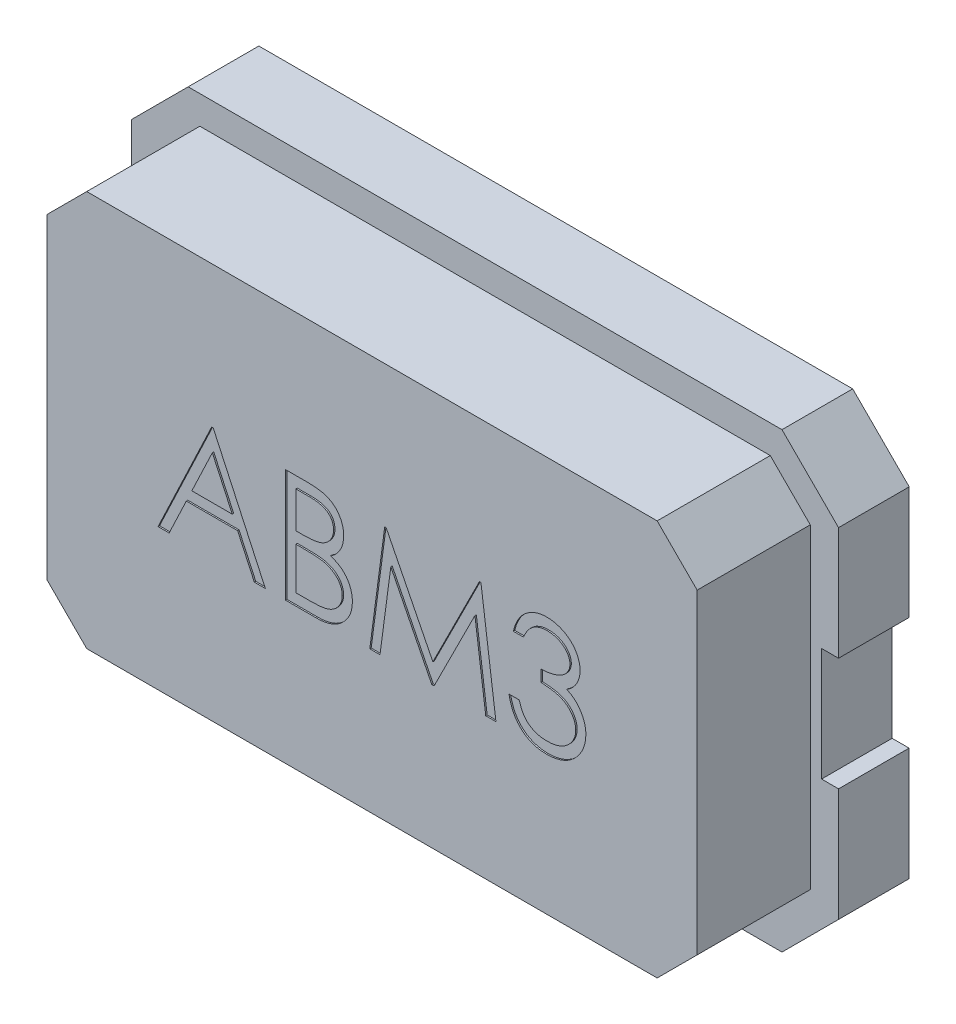
from build123d import *

# Parameters (mm, degrees)
SKETCH1_W           = 5
SKETCH1_H           = 3.2
BOSS_EXTRUDE1_DEPTH = 0.5
CHAMFER1_SIZE       = 0.4
BOSS_EXTRUDE2_DEPTH = 0.8
CUT_EXTRUDE1_DEPTH  = 0.01
SKETCH4_W           = 0.269976204
SKETCH4_H           = 0.8
CUT_EXTRUDE2_DEPTH  = 4.074085256
SKETCH6_W           = 1.3
SKETCH6_H           = 2
CUT_EXTRUDE3_DEPTH  = 0.001


with BuildPart() as part:
    # Sketch1 → Boss-Extrude1 (new body)
    with BuildSketch(Plane.XY):
        Rectangle(SKETCH1_W, SKETCH1_H)
    extrude(amount=BOSS_EXTRUDE1_DEPTH)

    # Chamfer1
    chamfer1_edges = [part.edges().sort_by_distance(p)[0] for p in [
        (2.5, -1.6, 0.25),
        (-2.5, -1.6, 0.25),
        (-2.5, 1.6, 0.25),
        (2.5, 1.6, 0.25),
    ]]
    chamfer(chamfer1_edges, length=CHAMFER1_SIZE)

    # Sketch2 → Boss-Extrude2 (add)
    with BuildSketch(Plane.XY.offset(0.5)):
        Polygon((2.017157288, 1.4), (-2.017157288, 1.4), (-2.3, 1.117157288), (-2.3, -1.117157288), (-2.017157288, -1.4), (2.017157288, -1.4), (2.3, -1.117157288), (2.3, 1.117157288), align=None)
    extrude(amount=BOSS_EXTRUDE2_DEPTH)

    # Sketch3 → Cut-Extrude1 (cut)
    # profile 1 of 4: a face of its own
    with BuildSketch(Plane.XY.offset(1.3)):
        Polygon((-1.123076923, 0.4), (-0.753846154, -0.4), (-0.831891026, -0.4), (-0.950160256, -0.143589744), (-1.312820513, -0.143589744), (-1.434455128, -0.4), (-1.512820513, -0.4), (-1.133333333, 0.4), align=None)
        Polygon((-1.12900641, 0.244070513), (-1.273878205, -0.061538462), (-0.987980769, -0.061538462), align=None, mode=Mode.SUBTRACT)
    # profile 2 of 4: a face of its own
    with BuildSketch(Plane.XY.offset(1.3)):
        with BuildLine():
            Line((-0.61025641, 0.4), (-0.454166667, 0.4))
            add(Edge.make_bspline(
                [(-0.454166667, 0.4), (-0.446525872, 0.399959828), (-0.431716109, 0.399881966), (-0.410180237, 0.398674393), (-0.39000908, 0.39702784), (-0.371196789, 0.394415248), (-0.353752057, 0.391262841), (-0.337622312, 0.387445283), (-0.322858844, 0.382867772), (-0.305233075, 0.375588622), (-0.285136924, 0.364771897), (-0.263377292, 0.348788225), (-0.244770608, 0.329237948), (-0.228728022, 0.30718477), (-0.21597348, 0.282925165), (-0.206746212, 0.25703735), (-0.200904412, 0.229855238), (-0.200303627, 0.21119394), (-0.2, 0.201762821)],
                knots=[0, 0, 0, 0, 1.001505555, 1.941167018, 2.826882275, 3.653841531, 4.429895133, 5.150066043, 5.825578002, 6.45369114, 7.647487171, 8.808567382, 9.977351308, 11.170798116, 12.373658725, 13.556498008, 14.765093433, 16, 16, 16, 16], degree=3))
            add(Edge.make_bspline(
                [(-0.2, 0.201762821), (-0.200249879, 0.192927951), (-0.200740913, 0.175566598), (-0.205436401, 0.150173659), (-0.212787411, 0.126001952), (-0.223005754, 0.103139692), (-0.23628621, 0.082103438), (-0.252025254, 0.062723491), (-0.271014238, 0.045820393), (-0.285241264, 0.036370586), (-0.292467949, 0.031570513)],
                knots=[0, 0, 0, 0, 1.044552857, 2.05264487, 3.044412934, 4.028983338, 5.005914585, 5.980388656, 6.974128949, 8, 8, 8, 8], degree=3))
            add(Edge.make_bspline(
                [(-0.292467949, 0.031570513), (-0.283379851, 0.02808137), (-0.265992069, 0.021405776), (-0.242063837, 0.009603384), (-0.221447873, -0.00323367), (-0.203985668, -0.017252378), (-0.189051347, -0.032362963), (-0.176010674, -0.04878699), (-0.164883503, -0.066738706), (-0.155349121, -0.086030942), (-0.147909405, -0.106466706), (-0.14233777, -0.127854312), (-0.13914521, -0.150117068), (-0.138690892, -0.165268012), (-0.138461538, -0.172916667)],
                knots=[0, 0, 0, 0, 1.27268992, 2.434971085, 3.483601985, 4.442670788, 5.356604649, 6.2567628, 7.179492994, 8.113709626, 9.066344395, 10.018646069, 10.999752585, 12, 12, 12, 12], degree=3))
            add(Edge.make_bspline(
                [(-0.138461538, -0.172916667), (-0.138684818, -0.180726237), (-0.139124125, -0.196091787), (-0.142365262, -0.218664389), (-0.147853058, -0.240235805), (-0.155412177, -0.260945561), (-0.165277849, -0.280753592), (-0.177284241, -0.299682338), (-0.191600027, -0.317541614), (-0.207614397, -0.33452987), (-0.225731458, -0.349804793), (-0.245277917, -0.363408383), (-0.266499933, -0.374596055), (-0.28904896, -0.383994002), (-0.313177946, -0.391172791), (-0.338778542, -0.396195093), (-0.365828669, -0.399579102), (-0.384390897, -0.39985732), (-0.393910256, -0.4)],
                knots=[0, 0, 0, 0, 0.978564426, 1.925352924, 2.850884081, 3.763762016, 4.682927383, 5.618979971, 6.567305752, 7.547517671, 8.540179244, 9.531824382, 10.526200242, 11.540722885, 12.589160233, 13.674978461, 14.80764778, 16, 16, 16, 16], degree=3))
            Line((-0.393910256, -0.4), (-0.61025641, -0.4))
            Line((-0.61025641, -0.4), (-0.61025641, 0.4))
        make_face()
        with BuildLine():
            Line((-0.538461538, 0.317948718), (-0.538461538, 0.061538462))
            Line((-0.538461538, 0.061538462), (-0.490224359, 0.061538462))
            add(Edge.make_bspline(
                [(-0.490224359, 0.061538462), (-0.483173206, 0.061629873), (-0.469548941, 0.061806497), (-0.449818679, 0.062312444), (-0.431504389, 0.06372914), (-0.414637684, 0.065145428), (-0.399245126, 0.067448191), (-0.385360814, 0.070189248), (-0.372766849, 0.073088197), (-0.358243525, 0.078018366), (-0.341769708, 0.085304691), (-0.324207855, 0.09661254), (-0.308725691, 0.110080963), (-0.295652048, 0.125621755), (-0.284952283, 0.142734026), (-0.277520577, 0.161144741), (-0.272481198, 0.180395057), (-0.272025991, 0.193610658), (-0.271794872, 0.200320513)],
                knots=[0, 0, 0, 0, 1.156816544, 2.235205308, 3.236616184, 4.169592532, 5.011045266, 5.787822928, 6.49130361, 7.128639758, 8.301311294, 9.436451833, 10.541879658, 11.654887649, 12.756523258, 13.837046038, 14.901820046, 16, 16, 16, 16], degree=3))
            add(Edge.make_bspline(
                [(-0.271794872, 0.200320513), (-0.271915142, 0.204760689), (-0.272151064, 0.21347058), (-0.274083247, 0.226167575), (-0.277367264, 0.238109004), (-0.281585388, 0.249458515), (-0.287479946, 0.259861224), (-0.294420166, 0.269676811), (-0.302805467, 0.27857101), (-0.312349995, 0.286884038), (-0.323323395, 0.294254216), (-0.335719119, 0.300709248), (-0.349704873, 0.305907139), (-0.365044955, 0.310459403), (-0.381975489, 0.313656727), (-0.400301101, 0.316320359), (-0.420171894, 0.317676414), (-0.433919346, 0.317855925), (-0.441025641, 0.317948718)],
                knots=[0, 0, 0, 0, 0.91205012, 1.789085906, 2.630437955, 3.453916878, 4.269457761, 5.079663411, 5.91843418, 6.774407191, 7.675494373, 8.627863946, 9.638891023, 10.736472738, 11.911756761, 13.175263542, 14.539845004, 16, 16, 16, 16], degree=3))
            Line((-0.441025641, 0.317948718), (-0.538461538, 0.317948718))
        make_face(mode=Mode.SUBTRACT)
        with BuildLine():
            Line((-0.538461538, -0.020512821), (-0.538461538, -0.317948718))
            Line((-0.538461538, -0.317948718), (-0.436217949, -0.317948718))
            add(Edge.make_bspline(
                [(-0.436217949, -0.317948718), (-0.428899337, -0.317861004), (-0.414793678, -0.317691948), (-0.394427683, -0.317140049), (-0.375551545, -0.315884672), (-0.358251399, -0.313908478), (-0.342340439, -0.311764832), (-0.328009535, -0.308882254), (-0.315142519, -0.305579634), (-0.300222678, -0.300474681), (-0.283421876, -0.292544059), (-0.265316537, -0.280586521), (-0.249219116, -0.266341194), (-0.235549342, -0.249854128), (-0.224346374, -0.231926967), (-0.216196555, -0.212922316), (-0.211170074, -0.193154195), (-0.210561578, -0.17967609), (-0.21025641, -0.172916667)],
                knots=[0, 0, 0, 0, 1.160039823, 2.235823828, 3.228722157, 4.157150951, 4.99529583, 5.772374946, 6.472645482, 7.099169577, 8.269452708, 9.405989375, 10.527446681, 11.663510218, 12.788923519, 13.866172445, 14.929861265, 16, 16, 16, 16], degree=3))
            add(Edge.make_bspline(
                [(-0.21025641, -0.172916667), (-0.21031952, -0.168689617), (-0.210444721, -0.160303702), (-0.212332862, -0.147980086), (-0.215078889, -0.136042743), (-0.218628931, -0.12445926), (-0.223799095, -0.113439059), (-0.229834877, -0.102764189), (-0.236911768, -0.092420536), (-0.247939006, -0.07934345), (-0.263978317, -0.064276704), (-0.286768437, -0.049525275), (-0.312682105, -0.037628633), (-0.331476961, -0.032577324), (-0.341185897, -0.029967949)],
                knots=[0, 0, 0, 0, 0.723448775, 1.435228256, 2.130040452, 2.821711965, 3.505591119, 4.210454504, 4.921174351, 5.648778258, 7.137944449, 8.670945889, 10.280296675, 12, 12, 12, 12], degree=3))
            add(Edge.make_bspline(
                [(-0.341185897, -0.029967949), (-0.345078262, -0.029178215), (-0.353517712, -0.02746591), (-0.367279445, -0.025658435), (-0.3829905, -0.024048136), (-0.400687158, -0.022857014), (-0.420391807, -0.021625804), (-0.442146532, -0.021146988), (-0.465862489, -0.020575728), (-0.482317889, -0.020534326), (-0.490865385, -0.020512821)],
                knots=[0, 0, 0, 0, 0.634451884, 1.375622551, 2.216452059, 3.157844607, 4.20941857, 5.370758133, 6.634282058, 8, 8, 8, 8], degree=3))
            Line((-0.490865385, -0.020512821), (-0.538461538, -0.020512821))
        make_face(mode=Mode.SUBTRACT)
    # profile 3 of 4: a face of its own
    with BuildSketch(Plane.XY.offset(1.3)):
        Polygon((-0.015384615, -0.4), (0.090224359, 0.4), (0.100480769, 0.4), (0.430769231, -0.256410256), (0.76025641, 0.4), (0.770673077, 0.4), (0.876923077, -0.4), (0.804807692, -0.4), (0.728205128, 0.175641026), (0.439423077, -0.4), (0.423237179, -0.4), (0.133333333, 0.176923077), (0.056891026, -0.4), align=None)
    # profile 4 of 4: a face of its own
    with BuildSketch(Plane.XY.offset(1.3)):
        with BuildLine():
            Line((1.071794872, 0.215384615), (1, 0.215384615))
            add(Edge.make_bspline(
                [(1, 0.215384615), (1.00194504, 0.223437755), (1.005747435, 0.239180983), (1.013678309, 0.261674071), (1.022318138, 0.282959448), (1.032692791, 0.30263855), (1.044009077, 0.321106871), (1.056974271, 0.337945528), (1.070990207, 0.353582777), (1.086493053, 0.367460088), (1.102751033, 0.380026427), (1.119993232, 0.390740725), (1.13787275, 0.399957675), (1.156513466, 0.40755087), (1.175970877, 0.41327099), (1.196069077, 0.417421117), (1.216860734, 0.420116229), (1.230974469, 0.42037926), (1.238141026, 0.420512821)],
                knots=[0, 0, 0, 0, 1.162005537, 2.271625781, 3.343758855, 4.383309926, 5.390229558, 6.379919256, 7.361854164, 8.333198761, 9.295911338, 10.242430842, 11.177959212, 12.116337295, 13.062827104, 14.020064771, 14.994644689, 16, 16, 16, 16], degree=3))
            add(Edge.make_bspline(
                [(1.238141026, 0.420512821), (1.248582795, 0.420197568), (1.269238569, 0.419573939), (1.299584408, 0.413879211), (1.328847681, 0.404867752), (1.356708081, 0.392416614), (1.38258658, 0.377059514), (1.405611994, 0.35878186), (1.425472225, 0.337936305), (1.442133797, 0.314911719), (1.455179511, 0.290304746), (1.464799254, 0.264978996), (1.470655638, 0.238994545), (1.471414622, 0.221450024), (1.471794872, 0.212660256)],
                knots=[0, 0, 0, 0, 1.083050992, 2.142477498, 3.193116406, 4.255571735, 5.30263384, 6.308962982, 7.297363603, 8.282367274, 9.249857812, 10.179914175, 11.08814088, 12, 12, 12, 12], degree=3))
            add(Edge.make_bspline(
                [(1.471794872, 0.212660256), (1.471528908, 0.20420156), (1.471008459, 0.187649205), (1.466589326, 0.163484292), (1.459152466, 0.140709069), (1.448850806, 0.11922766), (1.435515594, 0.099176268), (1.419361835, 0.080509779), (1.400275512, 0.0631454), (1.385811755, 0.053198092), (1.378365385, 0.048076923)],
                knots=[0, 0, 0, 0, 1.024540389, 2.004866551, 2.965041327, 3.920577974, 4.882998113, 5.874504559, 6.905732034, 8, 8, 8, 8], degree=3))
            add(Edge.make_bspline(
                [(1.378365385, 0.048076923), (1.3868755, 0.043967627), (1.4037365, 0.035825922), (1.426719478, 0.019858892), (1.447582992, 0.001423155), (1.459218128, -0.012963737), (1.465064103, -0.020192308)],
                knots=[0, 0, 0, 0, 1.015518401, 2.012035669, 3.001164323, 4, 4, 4, 4], degree=3))
            add(Edge.make_bspline(
                [(1.465064103, -0.020192308), (1.468913552, -0.025462651), (1.476549414, -0.035917032), (1.485974679, -0.052725358), (1.494525334, -0.069719984), (1.501188241, -0.08735642), (1.506347982, -0.105430251), (1.510036218, -0.123972513), (1.51232745, -0.142998347), (1.512655576, -0.155869771), (1.512820513, -0.162339744)],
                knots=[0, 0, 0, 0, 1.025084078, 2.033381695, 3.024893161, 4.013698104, 4.991890475, 5.976764909, 6.982997093, 8, 8, 8, 8], degree=3))
            add(Edge.make_bspline(
                [(1.512820513, -0.162339744), (1.512410338, -0.173541966), (1.51159192, -0.195893692), (1.504276703, -0.228916485), (1.492936533, -0.2611966), (1.476832091, -0.292070849), (1.457205232, -0.320957793), (1.433854986, -0.346803807), (1.407046664, -0.369020631), (1.37714823, -0.387582968), (1.344755744, -0.402421351), (1.310109894, -0.412720195), (1.273709882, -0.419427852), (1.248748214, -0.420147136), (1.236057692, -0.420512821)],
                knots=[0, 0, 0, 0, 0.955779014, 1.907060117, 2.875433937, 3.871313158, 4.872415639, 5.851225146, 6.836215519, 7.83643374, 8.849228613, 9.86973379, 10.916971861, 12, 12, 12, 12], degree=3))
            add(Edge.make_bspline(
                [(1.236057692, -0.420512821), (1.227504709, -0.420314372), (1.210675291, -0.419923891), (1.18593392, -0.417254496), (1.162317532, -0.412379066), (1.139794195, -0.405818311), (1.118343901, -0.397500198), (1.098032105, -0.387141639), (1.078733844, -0.374956153), (1.060631227, -0.360799904), (1.043726411, -0.344964169), (1.028468646, -0.327167824), (1.01460355, -0.307739846), (1.002502376, -0.286454576), (0.991613929, -0.263587089), (0.982658282, -0.238844575), (0.974775866, -0.212448227), (0.971111074, -0.194053315), (0.969230769, -0.184615385)],
                knots=[0, 0, 0, 0, 1.048658725, 2.063410685, 3.046034179, 4.001477787, 4.936774919, 5.862367409, 6.792675028, 7.730719943, 8.675894397, 9.627829632, 10.600096036, 11.597688215, 12.626045268, 13.701542398, 14.82072376, 16, 16, 16, 16], degree=3))
            Line((0.969230769, -0.184615385), (1.041025641, -0.184615385))
            add(Edge.make_bspline(
                [(1.041025641, -0.184615385), (1.042896108, -0.190775159), (1.046534328, -0.202756455), (1.05272731, -0.219999954), (1.059782915, -0.235807509), (1.067351957, -0.25029508), (1.075301316, -0.263605343), (1.084196156, -0.275386342), (1.093377675, -0.286155531), (1.10029867, -0.292222871), (1.103685897, -0.295192308)],
                knots=[0, 0, 0, 0, 1.198163088, 2.33053128, 3.407730985, 4.417276592, 5.372219308, 6.28897303, 7.162600585, 8, 8, 8, 8], degree=3))
            add(Edge.make_bspline(
                [(1.103685897, -0.295192308), (1.108165115, -0.298645641), (1.117109724, -0.305541648), (1.131685319, -0.314342021), (1.147014436, -0.321967398), (1.163429219, -0.327792243), (1.180575452, -0.332724279), (1.198730278, -0.335951827), (1.217733528, -0.338166266), (1.230709017, -0.338361679), (1.237339744, -0.338461538)],
                knots=[0, 0, 0, 0, 0.946170439, 1.889420265, 2.845303464, 3.807233317, 4.801018734, 5.828864929, 6.890507805, 8, 8, 8, 8], degree=3))
            add(Edge.make_bspline(
                [(1.237339744, -0.338461538), (1.244826258, -0.33832076), (1.259465492, -0.33804548), (1.280826603, -0.33551389), (1.301148305, -0.331826938), (1.320204974, -0.326132542), (1.338246233, -0.319096919), (1.355019181, -0.310262998), (1.370744005, -0.29989849), (1.385219298, -0.288118111), (1.398235414, -0.275221769), (1.409695874, -0.261733067), (1.419438654, -0.247708878), (1.427297758, -0.233071593), (1.433503598, -0.217881826), (1.437728329, -0.202096951), (1.440665818, -0.185846147), (1.440905044, -0.174799526), (1.441025641, -0.169230769)],
                knots=[0, 0, 0, 0, 1.217147791, 2.380027433, 3.494444702, 4.572153297, 5.609568379, 6.639424714, 7.649109417, 8.668170816, 9.669597737, 10.625200337, 11.543417969, 12.441394052, 13.322311151, 14.205496177, 15.095365482, 16, 16, 16, 16], degree=3))
            add(Edge.make_bspline(
                [(1.441025641, -0.169230769), (1.440675858, -0.161776749), (1.439978032, -0.146905798), (1.434650357, -0.125027496), (1.425887188, -0.103947859), (1.413619185, -0.084026535), (1.398685304, -0.065563472), (1.381230468, -0.04908999), (1.36110973, -0.035496827), (1.342590903, -0.026105134), (1.326187439, -0.019696659), (1.312149637, -0.015428096), (1.296433842, -0.011813546), (1.279230105, -0.008450741), (1.260408798, -0.005588719), (1.239990412, -0.003202018), (1.21797081, -0.001292294), (1.202727115, -0.000439473), (1.194871795, 0)],
                knots=[0, 0, 0, 0, 1.07054697, 2.135767047, 3.216561865, 4.33974944, 5.486079747, 6.621378074, 7.775625952, 8.963672916, 9.598146892, 10.304877434, 11.070270905, 11.915000392, 12.823868403, 13.805723172, 14.86925407, 16, 16, 16, 16], degree=3))
            Line((1.194871795, 0), (1.194871795, 0.082051282))
            add(Edge.make_bspline(
                [(1.194871795, 0.082051282), (1.204769204, 0.082219237), (1.224155798, 0.08254822), (1.252474496, 0.086527194), (1.27955411, 0.092031337), (1.304794508, 0.100462238), (1.327799928, 0.110254306), (1.347758695, 0.121649097), (1.364391185, 0.134315325), (1.377616573, 0.148448493), (1.387566111, 0.163606218), (1.394840808, 0.179404312), (1.399138025, 0.19598124), (1.399711663, 0.207294307), (1.4, 0.212980769)],
                knots=[0, 0, 0, 0, 1.321986639, 2.589447074, 3.816329219, 5.01088745, 6.139805852, 7.153945165, 8.075214402, 8.924034688, 9.728124013, 10.488707548, 11.240355623, 12, 12, 12, 12], degree=3))
            add(Edge.make_bspline(
                [(1.4, 0.212980769), (1.399905277, 0.21715854), (1.399716832, 0.225470015), (1.397340311, 0.237612888), (1.393769102, 0.249384533), (1.388859449, 0.26073489), (1.382287975, 0.271585238), (1.37442375, 0.282028084), (1.365059612, 0.292003804), (1.354329225, 0.301302163), (1.342806526, 0.310163703), (1.330178006, 0.31768682), (1.316824435, 0.324119977), (1.302731028, 0.329425006), (1.28785205, 0.333415701), (1.272257408, 0.336281036), (1.255917366, 0.3380725), (1.244769542, 0.338330423), (1.239102564, 0.338461538)],
                knots=[0, 0, 0, 0, 0.884392785, 1.759457502, 2.611959086, 3.489218968, 4.37281399, 5.2945488, 6.255912374, 7.266815255, 8.301784654, 9.332968512, 10.37626691, 11.440494194, 12.520033166, 13.637162961, 14.798855837, 16, 16, 16, 16], degree=3))
            add(Edge.make_bspline(
                [(1.239102564, 0.338461538), (1.229993611, 0.338143513), (1.212201708, 0.337522335), (1.186552584, 0.332081646), (1.162708165, 0.323400941), (1.144482184, 0.313039108), (1.13102331, 0.302810438), (1.121405724, 0.293877321), (1.111961036, 0.283949818), (1.103310596, 0.272416475), (1.094562258, 0.260058352), (1.086597787, 0.246247225), (1.078858429, 0.231343363), (1.074194989, 0.220807218), (1.071794872, 0.215384615)],
                knots=[0, 0, 0, 0, 1.472543308, 2.876219568, 4.221790263, 5.565193594, 6.249813518, 6.953379497, 7.687249741, 8.463570142, 9.283606569, 10.136032583, 11.040678096, 12, 12, 12, 12], degree=3))
        make_face()
    extrude(amount=-CUT_EXTRUDE1_DEPTH, mode=Mode.SUBTRACT)

    # Sketch4 → Cut-Extrude2 (cut, through all)
    with BuildSketch(Plane.XY.offset(0.5)):
        with Locations((-2.514988102, 0)):
            Rectangle(SKETCH4_W, SKETCH4_H)
    cut_extrude2 = extrude(amount=-CUT_EXTRUDE2_DEPTH, mode=Mode.SUBTRACT)

    # Sketch6 → Cut-Extrude3 (cut)
    with BuildSketch(Plane(origin=(0, 0, 0), x_dir=(-1, 0, 0), z_dir=(0, 0, -1))):
        with Locations((1.85, 0)):
            Rectangle(SKETCH6_W, SKETCH6_H)
    cut_extrude3 = extrude(amount=-CUT_EXTRUDE3_DEPTH, mode=Mode.SUBTRACT)

    # Mirror1: Cut-Extrude2, Cut-Extrude3 across plane
    add(cut_extrude2.mirror(Plane(origin=(0, 0, 0), x_dir=(0, 0, 1), z_dir=(1, 0, 0))), mode=Mode.SUBTRACT)
    add(cut_extrude3.mirror(Plane(origin=(0, 0, 0), x_dir=(0, 0, 1), z_dir=(1, 0, 0))), mode=Mode.SUBTRACT)


solid = part.part
